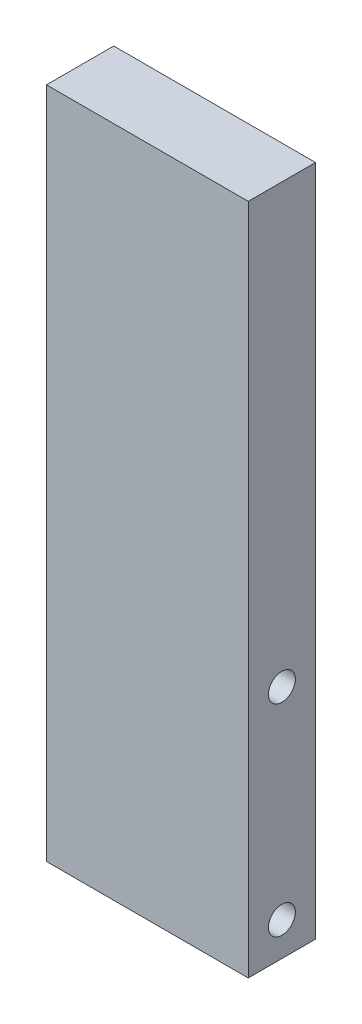
from build123d import *

# Parameters (mm, degrees)
SKETCH1_W           = 30
SKETCH1_H           = 100
BOSS_EXTRUDE1_DEPTH = 10
SKETCH2_R           = 2
CUT_EXTRUDE1_DEPTH  = 105.880884817


with BuildPart() as part:
    # Sketch1 → Boss-Extrude1 (new body)
    with BuildSketch(Plane.XY):
        with Locations((15, 50)):
            Rectangle(SKETCH1_W, SKETCH1_H)
    extrude(amount=BOSS_EXTRUDE1_DEPTH)

    # Sketch2 → Cut-Extrude1 (cut, through all)
    with BuildSketch(Plane(origin=(30, 0, 0), x_dir=(0, 0, -1), z_dir=(1, 0, 0))):
        with Locations((-5, 5)):
            Circle(SKETCH2_R)
        with Locations((-5, 35)):
            Circle(SKETCH2_R)
    extrude(amount=-CUT_EXTRUDE1_DEPTH, mode=Mode.SUBTRACT)


solid = part.part
